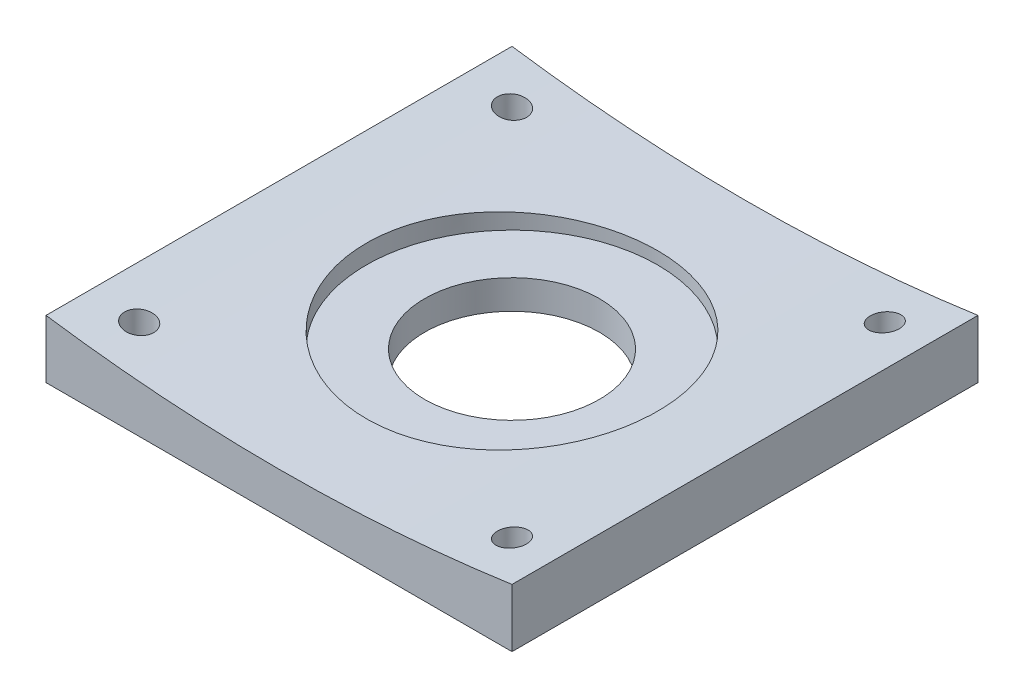
from build123d import *

# Parameters (mm, degrees)
SKETCH1_3_W         = 80
SKETCH1_3_H         = 80
SKETCH1_3_R         = 2.5
SKETCH1_3_R_2       = 15
BOSS_EXTRUDE3_DEPTH = 5
BOSS_EXTRUDE4_START = 5
SKETCH1_W           = 80
SKETCH1_H           = 80
SKETCH1_R           = 2.5
SKETCH1_R_2         = 25
BOSS_EXTRUDE4_DEPTH = 5
CUT_EXTRUDE1_DEPTH  = 90.582364336


with BuildPart() as part:
    # Sketch1<3> → Boss-Extrude3 (new body)
    with BuildSketch(Plane(origin=(0, 0, 0), x_dir=(1, 0, 0), z_dir=(0, 1, 0))):
        Rectangle(SKETCH1_3_W, SKETCH1_3_H)
        with Locations((-32, -32)):
            Circle(SKETCH1_3_R, mode=Mode.SUBTRACT)
        with Locations((32, -32)):
            Circle(SKETCH1_3_R, mode=Mode.SUBTRACT)
        with Locations((-32, 32)):
            Circle(SKETCH1_3_R, mode=Mode.SUBTRACT)
        with Locations((32, 32)):
            Circle(SKETCH1_3_R, mode=Mode.SUBTRACT)
        Circle(SKETCH1_3_R_2, mode=Mode.SUBTRACT)
    extrude(amount=-BOSS_EXTRUDE3_DEPTH)

    # Sketch1 → Boss-Extrude4 (add)
    with BuildSketch(Plane(origin=(0, 0, 0), x_dir=(1, 0, 0), z_dir=(0, 1, 0)).offset(BOSS_EXTRUDE4_START)):
        Rectangle(SKETCH1_W, SKETCH1_H)
        with Locations((-32, -32)):
            Circle(SKETCH1_R, mode=Mode.SUBTRACT)
        with Locations((32, -32)):
            Circle(SKETCH1_R, mode=Mode.SUBTRACT)
        Circle(SKETCH1_R_2, mode=Mode.SUBTRACT)
        with Locations((-32, 32)):
            Circle(SKETCH1_R, mode=Mode.SUBTRACT)
        with Locations((32, 32)):
            Circle(SKETCH1_R, mode=Mode.SUBTRACT)
    extrude(amount=-BOSS_EXTRUDE4_DEPTH)

    # Sketch5 → Cut-Extrude1 (cut, through all)
    with BuildSketch(Plane(origin=(0, 0, -40), x_dir=(-1, 0, 0), z_dir=(0, 0, -1))):
        with BuildLine():
            Line((40, 5), (-40, 5))
            ThreePointArc((-40, 5), (0, 2.128129211), (40, 5))
        make_face()
    extrude(amount=-CUT_EXTRUDE1_DEPTH, mode=Mode.SUBTRACT)


solid = part.part
